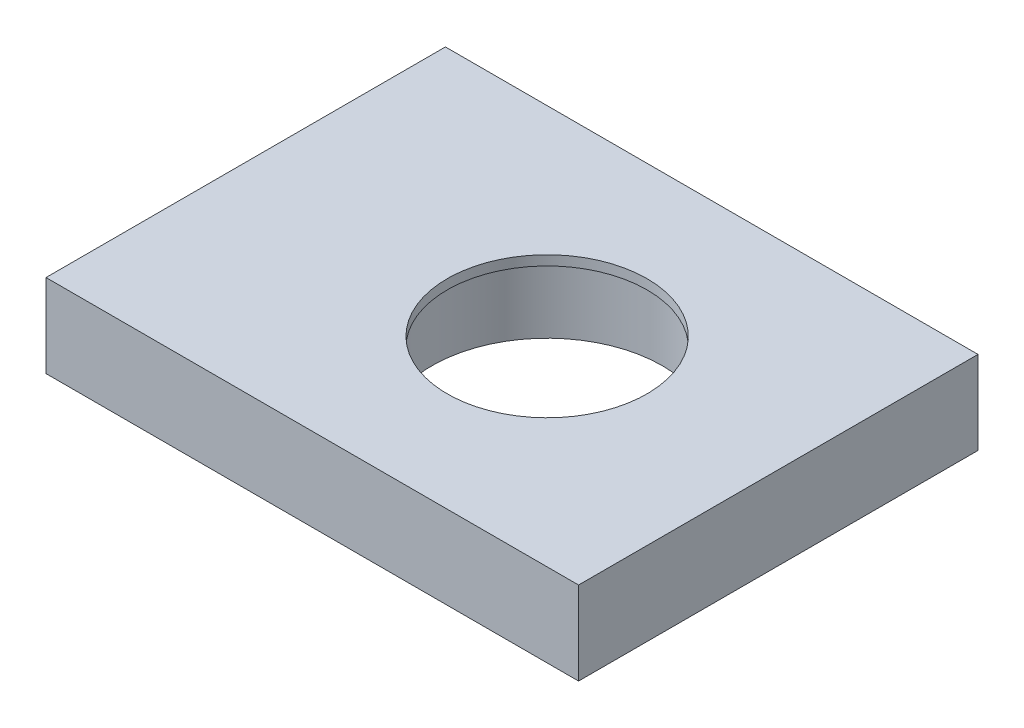
from build123d import *

# Parameters (mm, degrees)
SKETCH1_W          = 50.8
SKETCH1_H          = 38.1
BODY_DEPTH         = 7.9375
SKETCH_1_R         = 9.525
THRU_HOLE_DEPTH    = 33.727150903
SKETCH4_R          = 10.9982
BEARING_BORE_DEPTH = 7.0104
SKETCH5_R          = 1.4986
DOWEL_HOLES_DEPTH  = 6.5


with BuildPart() as part:
    # Sketch1 → Body (new body)
    with BuildSketch(Plane(origin=(0, 0, 0), x_dir=(1, 0, 0), z_dir=(0, 1, 0))):
        Rectangle(SKETCH1_W, SKETCH1_H)
    extrude(amount=BODY_DEPTH)

    # Sketch 1 → Thru Hole (cut, through all)
    with BuildSketch(Plane.XZ):
        with Locations(Location((3.3528, 0, 0), (0, 0, 270))):
            Circle(SKETCH_1_R)
    extrude(amount=-THRU_HOLE_DEPTH, mode=Mode.SUBTRACT)

    # Sketch4 → Bearing Bore (cut)
    with BuildSketch(Plane.XZ):
        with Locations(Location((3.3528, 0, 0), (0, 0, 270))):
            Circle(SKETCH4_R)
    extrude(amount=-BEARING_BORE_DEPTH, mode=Mode.SUBTRACT)

    # Sketch5 → Dowel Holes (cut)
    with BuildSketch(Plane.XZ):
        with Locations(Location((-21.4249, 14.986, 0), (0, 0, 270))):
            Circle(SKETCH5_R)
        with Locations(Location((-21.4249, 4.995333333, 0), (0, 0, 270))):
            Circle(SKETCH5_R)
        with Locations(Location((-21.4249, -14.986, 0), (0, 0, 270))):
            Circle(SKETCH5_R)
        with Locations(Location((-21.4249, -4.995333333, 0), (0, 0, 270))):
            Circle(SKETCH5_R)
    extrude(amount=-DOWEL_HOLES_DEPTH, mode=Mode.SUBTRACT)


solid = part.part
